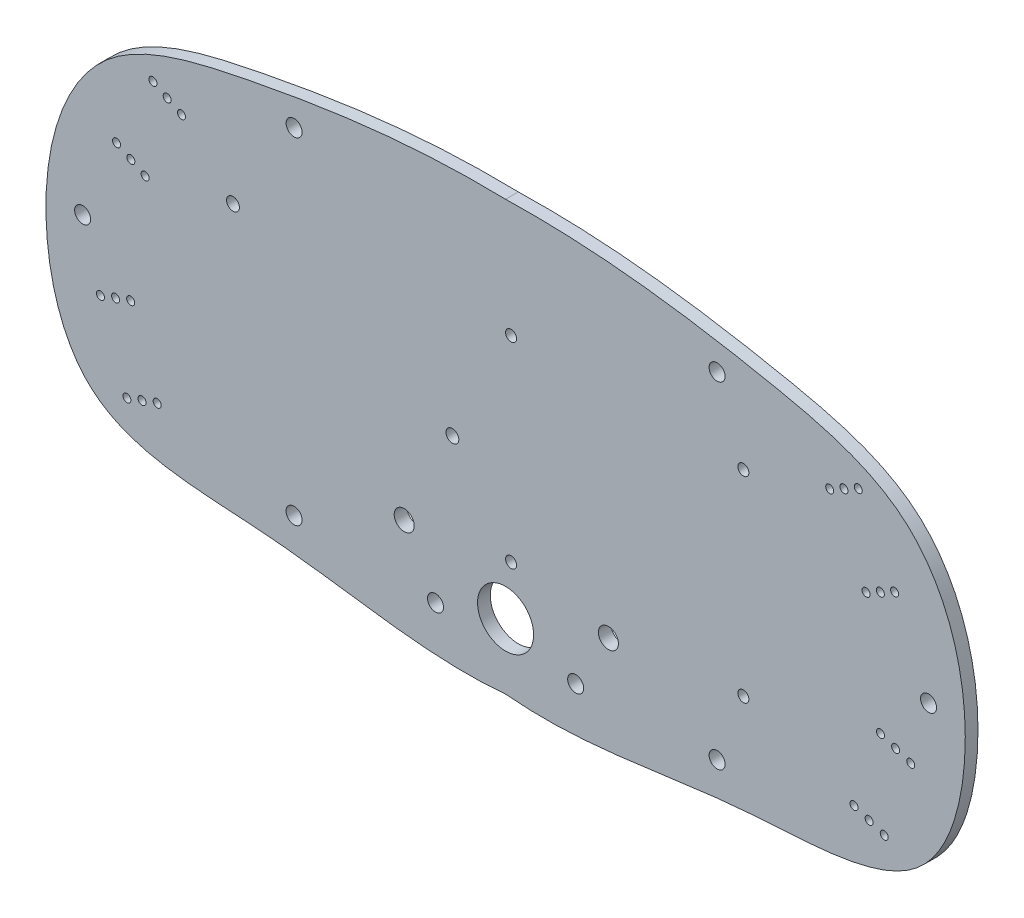
from build123d import *

# Parameters (mm, degrees)
SKETCH2_R           = 2
SKETCH2_R_2         = 1
BOSS_EXTRUDE1_DEPTH = 3.175
SKETCH3_R           = 2.5
CUT_EXTRUDE1_DEPTH  = 158.042768909
SKETCH6_R           = 1.6
CUT_EXTRUDE3_DEPTH  = 158.042768909
SKETCH7_R           = 7
CUT_EXTRUDE4_DEPTH  = 10
SKETCH8_R           = 1.375
CUT_EXTRUDE5_DEPTH  = 158.042768909


with BuildPart() as part:
    # Sketch2 → Boss-Extrude1 (new body)
    with BuildSketch(Plane.XY):
        with BuildLine():
            add(Edge.make_bspline(
                [(0, 0), (-20.953042836, -1.917303519), (-52.065437904, 6.559869489), (-106.076791765, 5.027195947), (-118.905582253, 49.201905636), (-106.996491135, 91.130942668), (-54.792097317, 103.392327906), (-22.685606194, 107.573305963), (0, 107.040782028)],
                knots=[0, 0, 0, 0, 0.212420464, 0.369252369, 0.478798271, 0.640373923, 0.766905531, 1, 1, 1, 1], degree=3))
            add(Edge.make_bspline(
                [(0, 0), (20.953042836, -1.917303519), (52.065437904, 6.559869489), (106.076791765, 5.027195947), (118.905582253, 49.201905636), (106.996491135, 91.130942668), (54.792097317, 103.392327906), (22.685606194, 107.573305963), (0, 107.040782028)],
                knots=[0, 0, 0, 0, 0.212420464, 0.369252369, 0.478798271, 0.640373923, 0.766905531, 1, 1, 1, 1], degree=3))
        make_face()
        with Locations((105.629435859, 50.875493963)):
            Circle(SKETCH2_R, mode=Mode.SUBTRACT)
        with Locations((97.408827326, 36.971043837)):
            Circle(SKETCH2_R_2, mode=Mode.SUBTRACT)
        with Locations((90.790231972, 18.097936103)):
            Circle(SKETCH2_R_2, mode=Mode.SUBTRACT)
        with Locations((90.025202431, 67.044063381)):
            Circle(SKETCH2_R_2, mode=Mode.SUBTRACT)
        with Locations((80.946686803, 84.864853319)):
            Circle(SKETCH2_R_2, mode=Mode.SUBTRACT)
        with Locations((52.824538288, 12.232829458)):
            Circle(SKETCH2_R, mode=Mode.SUBTRACT)
        with Locations((17.5, 11)):
            Circle(SKETCH2_R, mode=Mode.SUBTRACT)
        with Locations(Location((-17.5, 11, 0), (0, 0, 180))):
            Circle(SKETCH2_R, mode=Mode.SUBTRACT)
        with Locations(Location((-52.824538288, 12.232829458, 0), (0, 0, 180))):
            Circle(SKETCH2_R, mode=Mode.SUBTRACT)
        with Locations(Location((-105.629435859, 50.875493963, 0), (0, 0, 180))):
            Circle(SKETCH2_R, mode=Mode.SUBTRACT)
        with Locations((93.634205779, 38.294762908)):
            Circle(SKETCH2_R_2, mode=Mode.SUBTRACT)
        with Locations((87.015610425, 19.421655174)):
            Circle(SKETCH2_R_2, mode=Mode.SUBTRACT)
        with Locations(Location((84.51084479, 86.680556444, 0), (0, 0, 180))):
            Circle(SKETCH2_R_2, mode=Mode.SUBTRACT)
        with Locations(Location((93.589360419, 68.859766507, 0), (0, 0, 180))):
            Circle(SKETCH2_R_2, mode=Mode.SUBTRACT)
        with Locations(Location((88.075002778, 88.49625957, 0), (0, 0, 180))):
            Circle(SKETCH2_R_2, mode=Mode.SUBTRACT)
        with Locations(Location((97.153518406, 70.675469633, 0), (0, 0, 180))):
            Circle(SKETCH2_R_2, mode=Mode.SUBTRACT)
        with Locations(Location((101.183448873, 35.647324767, 0), (0, 0, 180))):
            Circle(SKETCH2_R_2, mode=Mode.SUBTRACT)
        with Locations(Location((94.564853519, 16.774217033, 0), (0, 0, 180))):
            Circle(SKETCH2_R_2, mode=Mode.SUBTRACT)
        with Locations((52.824538288, 96.099280066)):
            Circle(SKETCH2_R, mode=Mode.SUBTRACT)
        with Locations(Location((-52.824538288, 96.099280066, 0), (0, 0, 180))):
            Circle(SKETCH2_R, mode=Mode.SUBTRACT)
        with Locations(Location((-90.025202431, 67.044063381, 0), (0, 0, 180))):
            Circle(SKETCH2_R_2, mode=Mode.SUBTRACT)
        with Locations((-93.589360419, 68.859766507)):
            Circle(SKETCH2_R_2, mode=Mode.SUBTRACT)
        with Locations((-97.153518406, 70.675469633)):
            Circle(SKETCH2_R_2, mode=Mode.SUBTRACT)
        with Locations((-88.075002778, 88.49625957)):
            Circle(SKETCH2_R_2, mode=Mode.SUBTRACT)
        with Locations((-84.51084479, 86.680556444)):
            Circle(SKETCH2_R_2, mode=Mode.SUBTRACT)
        with Locations(Location((-80.946686803, 84.864853319, 0), (0, 0, 180))):
            Circle(SKETCH2_R_2, mode=Mode.SUBTRACT)
        with Locations((-101.183448873, 35.647324767)):
            Circle(SKETCH2_R_2, mode=Mode.SUBTRACT)
        with Locations(Location((-97.408827326, 36.971043837, 0), (0, 0, 180))):
            Circle(SKETCH2_R_2, mode=Mode.SUBTRACT)
        with Locations(Location((-93.634205779, 38.294762908, 0), (0, 0, 180))):
            Circle(SKETCH2_R_2, mode=Mode.SUBTRACT)
        with Locations((-94.564853519, 16.774217033)):
            Circle(SKETCH2_R_2, mode=Mode.SUBTRACT)
        with Locations(Location((-90.790231972, 18.097936103, 0), (0, 0, 180))):
            Circle(SKETCH2_R_2, mode=Mode.SUBTRACT)
        with Locations(Location((-87.015610425, 19.421655174, 0), (0, 0, 180))):
            Circle(SKETCH2_R_2, mode=Mode.SUBTRACT)
    extrude(amount=BOSS_EXTRUDE1_DEPTH)

    # Sketch3 → Cut-Extrude1 (cut, through all)
    with BuildSketch(Plane.XY.offset(3.175)):
        with Locations((25.67875751, 24.983800797)):
            Circle(SKETCH3_R)
        with Locations(Location((-25.32124249, 24.983800797, 0), (0, 0, 180))):
            Circle(SKETCH3_R)
    extrude(amount=-CUT_EXTRUDE1_DEPTH, mode=Mode.SUBTRACT)

    # Sketch6 → Cut-Extrude3 (cut, through all)
    with BuildSketch(Plane.XY.offset(3.175)):
        with Locations((-13.286825274, 49.207700743)):
            Circle(SKETCH6_R)
        with Locations((-68.086825274, 72.007700743)):
            Circle(SKETCH6_R)
    extrude(amount=-CUT_EXTRUDE3_DEPTH, mode=Mode.SUBTRACT)

    # Sketch7 → Cut-Extrude4 (cut)
    with BuildSketch(Plane(origin=(0, 0, 0), x_dir=(-1, 0, 0), z_dir=(0, 0, -1))):
        with Locations((0, 16.306104536)):
            Circle(SKETCH7_R)
    extrude(amount=-CUT_EXTRUDE4_DEPTH, mode=Mode.SUBTRACT)

    # Sketch8 → Cut-Extrude5 (cut, through all)
    with BuildSketch(Plane(origin=(0, 0, 0), x_dir=(-1, 0, 0), z_dir=(0, 0, -1))):
        with Locations((-59.376462102, 29.241782778)):
            Circle(SKETCH8_R)
        with Locations((-59.376462102, 78.241782778)):
            Circle(SKETCH8_R)
        with Locations((-1.376462102, 78.241782778)):
            Circle(SKETCH8_R)
        with Locations((-1.376462102, 29.241782778)):
            Circle(SKETCH8_R)
    extrude(amount=-CUT_EXTRUDE5_DEPTH, mode=Mode.SUBTRACT)


solid = part.part
